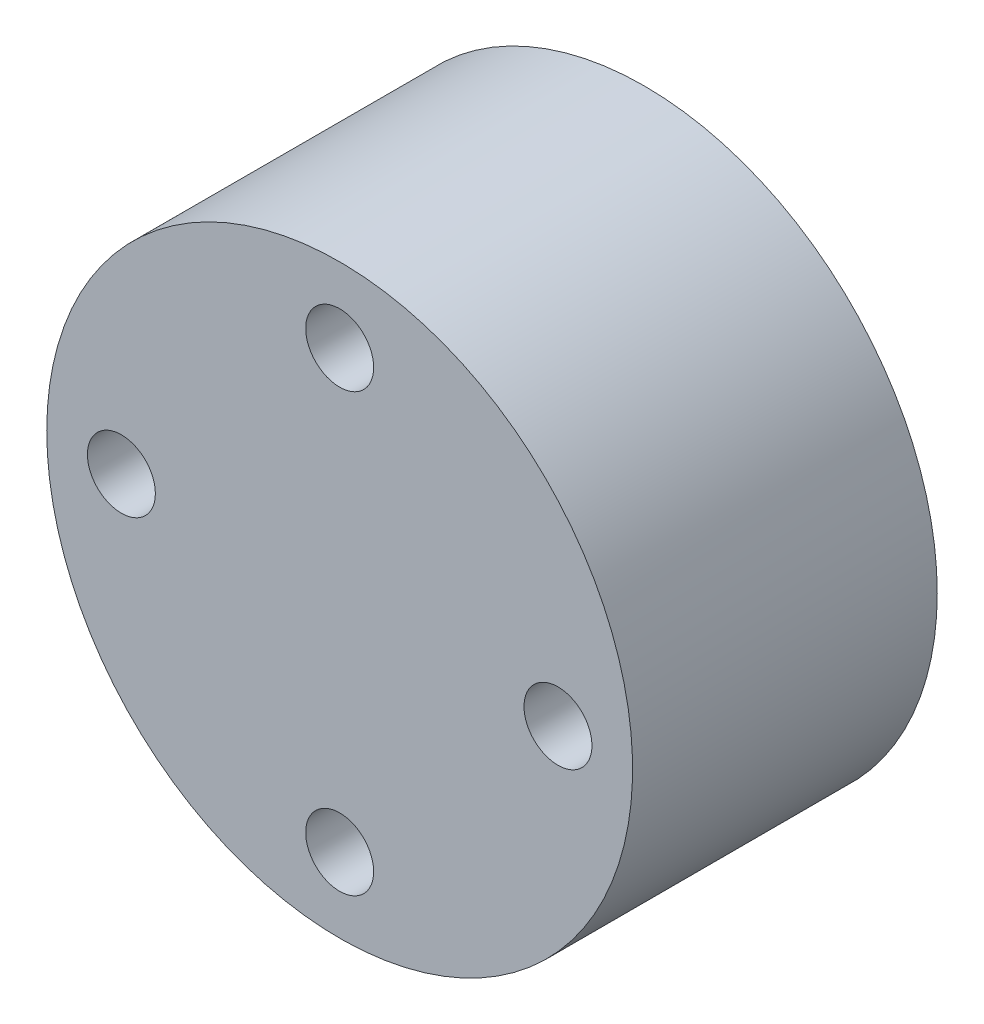
from build123d import *
from build123d.topology import SkipClean

# Parameters (mm, degrees)
SKETCH1_R           = 12.5
BOSS_EXTRUDE1_DEPTH = 5
SKETCH2_W           = 3
SKETCH2_H           = 12.5
SKETCH5_R           = 1.45
CUT_EXTRUDE1_DEPTH  = 5
SKETCH6_R           = 1.45
CUT_EXTRUDE2_DEPTH  = 5


with BuildPart() as part:
    # Sketch1 → Boss-Extrude1 (new, symmetric)
    with BuildSketch(Plane.XY):
        Circle(SKETCH1_R)
    extrude(amount=BOSS_EXTRUDE1_DEPTH, both=True)

    # Sketch2 → Revolve1 (revolve)
    with SkipClean():  # the faces are left unmerged after this step: merging them gives an invalid solid
        with BuildSketch(Plane(origin=(0, 0, 0), x_dir=(0, 0, -1), z_dir=(1, 0, 0)), mode=Mode.PRIVATE) as revolve1_sk:
            with Locations((-6.5, 6.25)):
                Rectangle(SKETCH2_W, SKETCH2_H)
        revolve(revolve1_sk.sketch.rotate(Axis((0, 0, 0), (0, 0, 1)), 90), axis=Axis((0, 0, 0), (0, 0, 1)))

    # Sketch5 → Cut-Extrude1 (cut)
    with SkipClean():  # the faces are left unmerged after this step: merging them gives an invalid solid
        with BuildSketch(Plane.XY.offset(8)):
            with Locations((0, 9.315)):
                Circle(SKETCH5_R)
            with Locations((9.315, 0)):
                Circle(SKETCH5_R)
            with Locations((0, -9.315)):
                Circle(SKETCH5_R)
            with Locations((-9.315, 0)):
                Circle(SKETCH5_R)
        extrude(amount=-CUT_EXTRUDE1_DEPTH, mode=Mode.SUBTRACT)

    # Sketch6 → Cut-Extrude2 (cut)
    with SkipClean():  # the faces are left unmerged after this step: merging them gives an invalid solid
        with BuildSketch(Plane(origin=(0, 0, -5), x_dir=(-1, 0, 0), z_dir=(0, 0, -1))):
            with Locations((0, 8)):
                Circle(SKETCH6_R)
            with Locations((8, 0)):
                Circle(SKETCH6_R)
            with Locations((0, -8)):
                Circle(SKETCH6_R)
            with Locations((-8, 0)):
                Circle(SKETCH6_R)
        extrude(amount=-CUT_EXTRUDE2_DEPTH, mode=Mode.SUBTRACT)


solid = part.part
